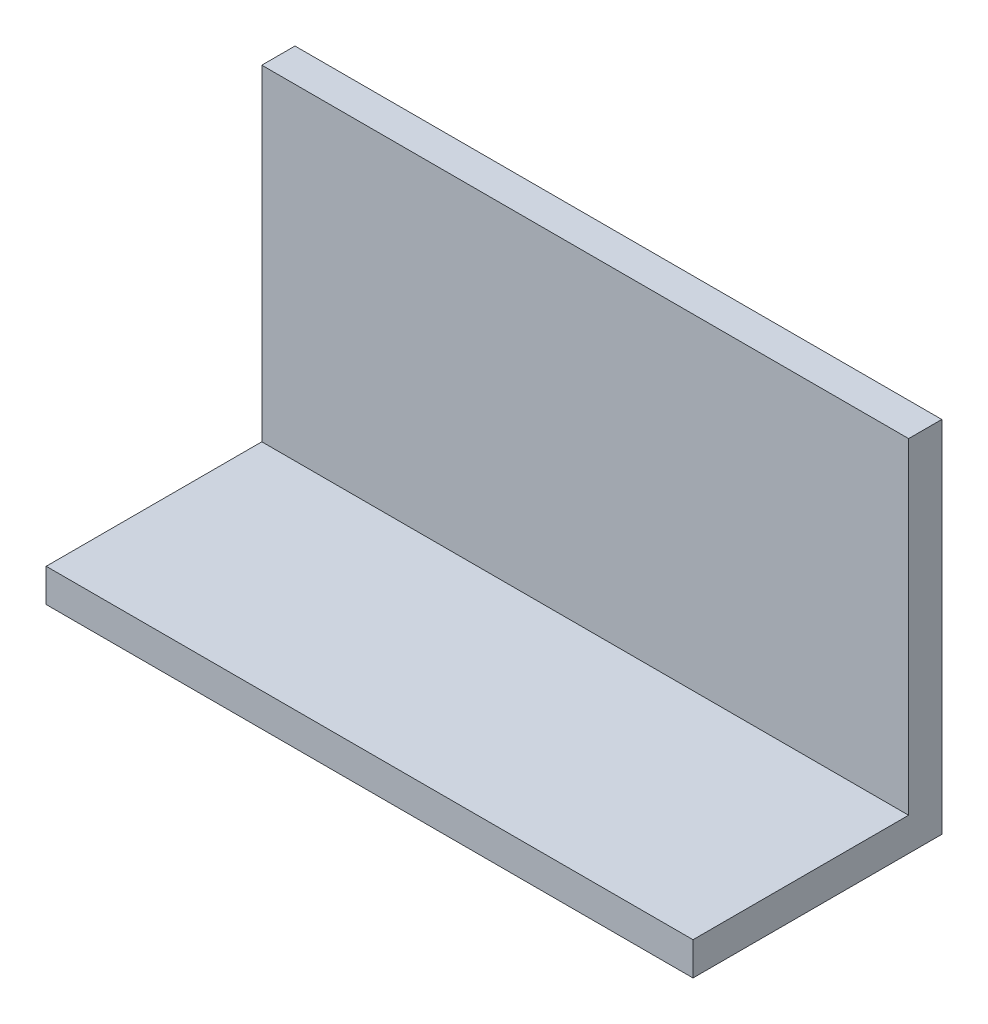
from build123d import *

# Parameters (mm, degrees)
SKETCH_1_W          = 234
SKETCH_1_H          = 130
EXTRUDE_1_DEPTH     = 90
SKETCH_2_W          = 78
SKETCH_2_H          = 118
CUT_EXTRUDE_1_DEPTH = 283.411047943


with BuildPart() as part:
    # 草图1 → 凸台-拉伸1 (new body)
    with BuildSketch(Plane.XY):
        with Locations((117, 65)):
            Rectangle(SKETCH_1_W, SKETCH_1_H)
    extrude(amount=EXTRUDE_1_DEPTH)

    # 草图2 → 切除-拉伸1 (cut, through all)
    with BuildSketch(Plane.ZY):
        with Locations((51, 71)):
            Rectangle(SKETCH_2_W, SKETCH_2_H)
    extrude(amount=-CUT_EXTRUDE_1_DEPTH, mode=Mode.SUBTRACT)


solid = part.part
